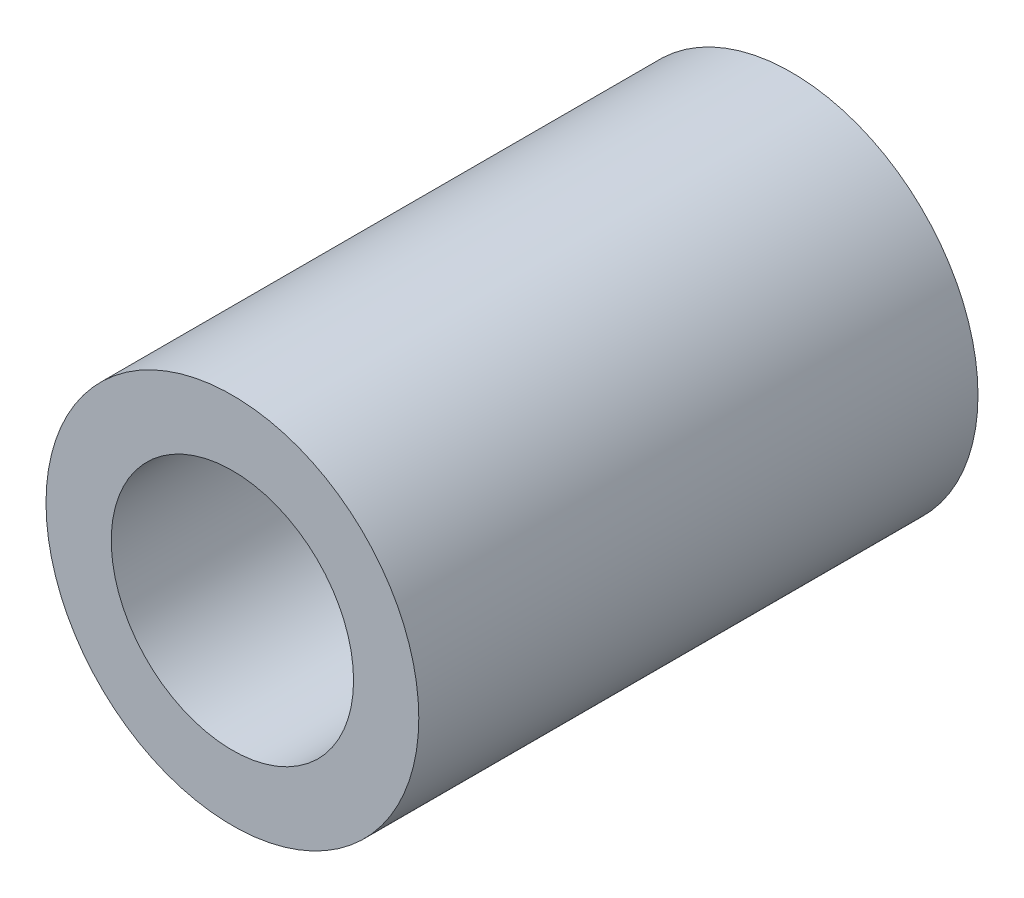
from build123d import *

# Parameters (mm, degrees)
CROQUIS1_R              = 4
CROQUIS1_R_2            = 2.6
SALIENTE_EXTRUIR1_DEPTH = 12


with BuildPart() as part:
    # Croquis1 → Saliente-Extruir1 (new body)
    with BuildSketch(Plane.XY):
        Circle(CROQUIS1_R)
        Circle(CROQUIS1_R_2, mode=Mode.SUBTRACT)
    extrude(amount=SALIENTE_EXTRUIR1_DEPTH)


solid = part.part
